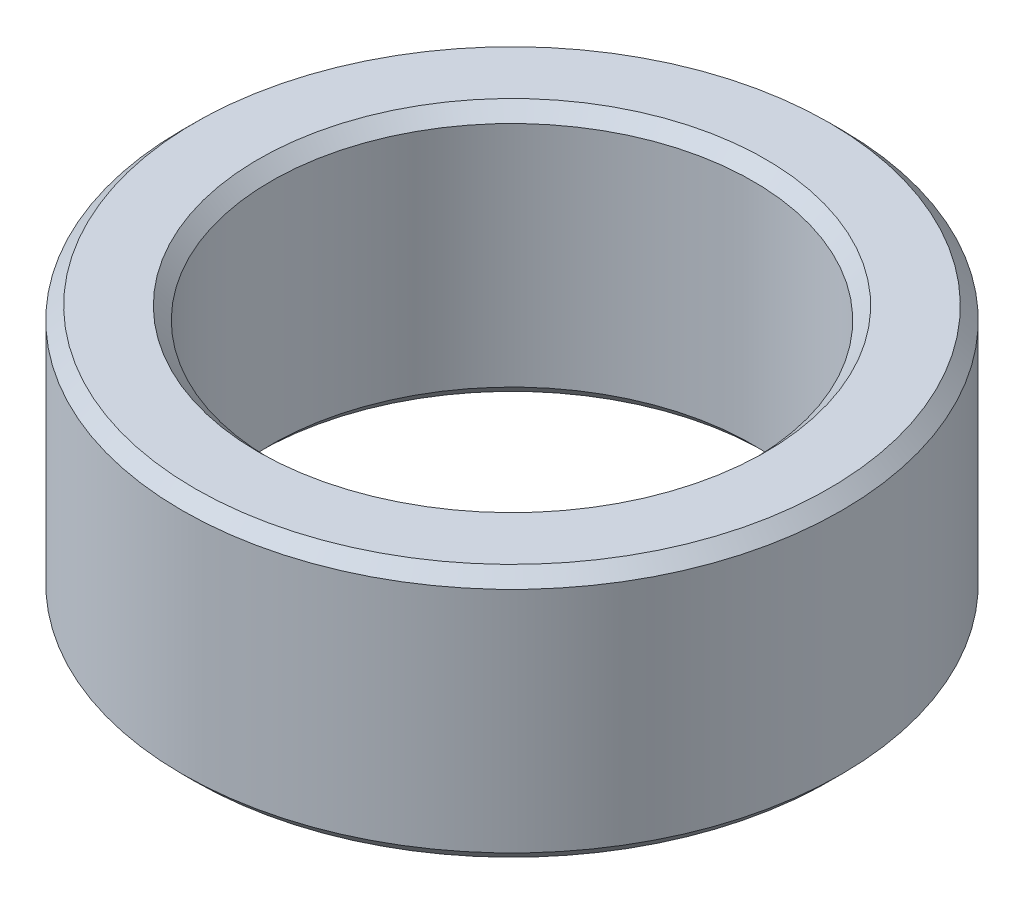
from build123d import *

# Parameters (mm, degrees)
SKETCH1_R           = 6.5
SKETCH1_R_2         = 4.75
BOSS_EXTRUDE1_DEPTH = 5
CHAMFER1_SIZE       = 0.25


with BuildPart() as part:
    # Sketch1 → Boss-Extrude1 (new body)
    with BuildSketch(Plane(origin=(0, 0, 0), x_dir=(1, 0, 0), z_dir=(0, 1, 0))):
        with Locations(Location((0, 0, 0), (0, 0, 270))):
            Circle(SKETCH1_R)
        with Locations(Location((0, 0, 0), (0, 0, 270))):
            Circle(SKETCH1_R_2, mode=Mode.SUBTRACT)
    extrude(amount=BOSS_EXTRUDE1_DEPTH)

    # Chamfer1
    chamfer1_edges = [part.edges().sort_by_distance(p)[0] for p in [
        (0, 0, -6.5),
        (0, 5, -6.5),
        (0, 0, -4.75),
        (0, 5, -4.75),
    ]]
    chamfer(chamfer1_edges, length=CHAMFER1_SIZE)


solid = part.part
